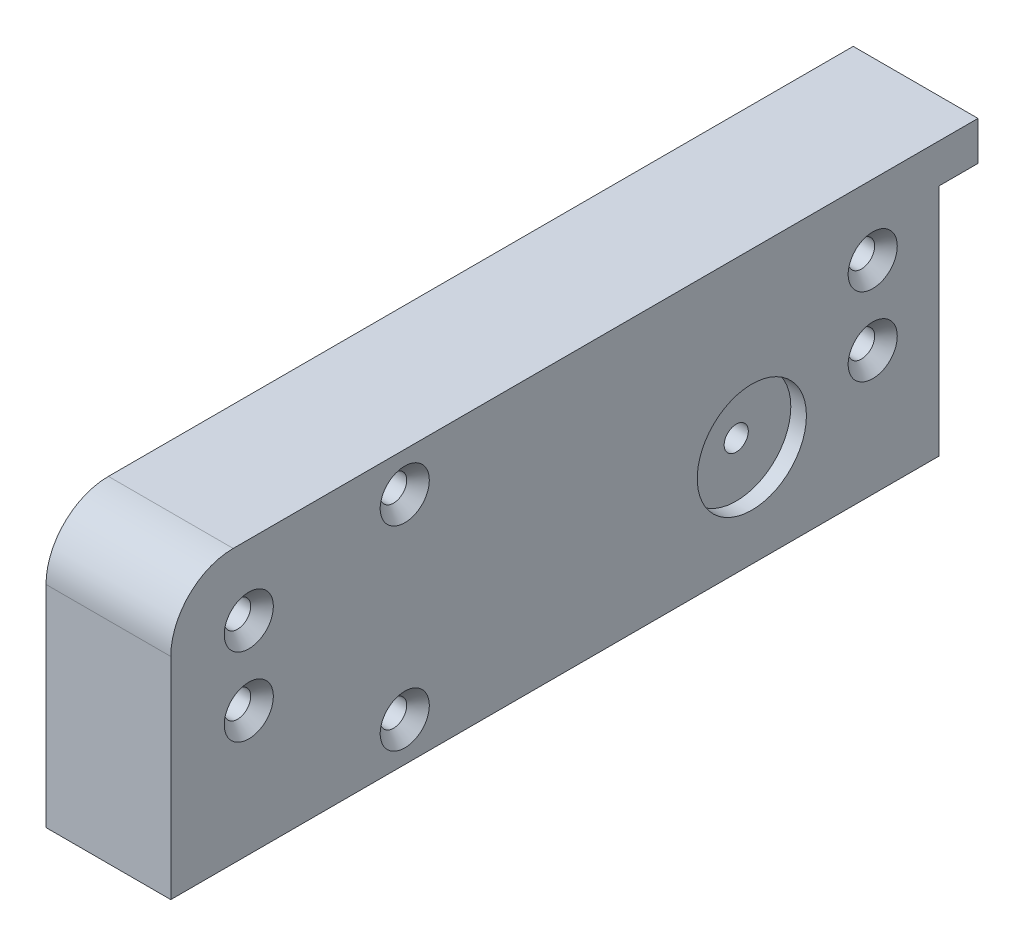
from build123d import *

# Parameters (mm, degrees)
BOSS_EXTRUDE1_DEPTH                                 = 16
CSK_FOR_M3_COUNTERSUNK_FLAT_HEAD_SCREW1_D           = 3.4
CSK_FOR_M3_COUNTERSUNK_FLAT_HEAD_SCREW1_CSINK_D     = 6.3
CSK_FOR_M3_COUNTERSUNK_FLAT_HEAD_SCREW1_CSINK_ANGLE = 90
CUT_EXTRUDE1_DEPTH                                  = 9
SKETCH5_R                                           = 4.1
CUT_EXTRUDE2_DEPTH                                  = 6
SKETCH6_R                                           = 1.55
CUT_EXTRUDE3_DEPTH                                  = 106.750886521
SKETCH7_R                                           = 7
CUT_EXTRUDE4_DEPTH                                  = 2
FILLET1_R                                           = 8


with BuildPart() as part:
    # Sketch1 → Boss-Extrude1 (new body)
    with BuildSketch(Plane(origin=(0, 0, 0), x_dir=(0, 0, -1), z_dir=(1, 0, 0))):
        Polygon((0, 0), (-98.5, 0), (-98.5, 35), (5, 35), (5, 30), (0, 30), align=None)
    extrude(amount=BOSS_EXTRUDE1_DEPTH)

    # CSK for M3 Countersunk Flat Head Screw1 (through all)
    with Locations(Plane(origin=(16, 26, 88.5), x_dir=(0, 0, 1), z_dir=(1, 0, 0))):
        with Locations((0, 0), (0, 10), (-20, -4), (-20, 21), (-80, 0), (-80, 10)):
            CounterSinkHole(CSK_FOR_M3_COUNTERSUNK_FLAT_HEAD_SCREW1_D / 2, CSK_FOR_M3_COUNTERSUNK_FLAT_HEAD_SCREW1_CSINK_D / 2, counter_sink_angle=CSK_FOR_M3_COUNTERSUNK_FLAT_HEAD_SCREW1_CSINK_ANGLE)

    # Sketch4 → Cut-Extrude1 (cut)
    with BuildSketch(Plane.ZY):
        Polygon((10.0875, 28.749630657), (6.9125, 28.749630657), (5.325, 26), (6.9125, 23.250369343), (10.0875, 23.250369343), (11.675, 26), align=None)
        Polygon((86.9125, 28.749630657), (85.325, 26), (86.9125, 23.250369343), (90.0875, 23.250369343), (91.675, 26), (90.0875, 28.749630657), align=None)
    extrude(amount=-CUT_EXTRUDE1_DEPTH, mode=Mode.SUBTRACT)

    # Sketch5 → Cut-Extrude2 (cut)
    with BuildSketch(Plane.ZY):
        with Locations((8.5, 26)):
            Circle(SKETCH5_R)
        with Locations((88.5, 26)):
            Circle(SKETCH5_R)
    extrude(amount=-CUT_EXTRUDE2_DEPTH, mode=Mode.SUBTRACT)

    # Sketch6 → Cut-Extrude3 (cut, through all)
    with BuildSketch(Plane(origin=(16, 0, 0), x_dir=(0, 0, -1), z_dir=(1, 0, 0))):
        with Locations((-24, 13)):
            Circle(SKETCH6_R)
    extrude(amount=-CUT_EXTRUDE3_DEPTH, mode=Mode.SUBTRACT)

    # Sketch7 → Cut-Extrude4 (cut)
    with BuildSketch(Plane(origin=(16, 0, 0), x_dir=(0, 0, -1), z_dir=(1, 0, 0))):
        with Locations((-24, 13)):
            Circle(SKETCH7_R)
    extrude(amount=-CUT_EXTRUDE4_DEPTH, mode=Mode.SUBTRACT)

    # Fillet1
    fillet1_edges = [part.edges().sort_by_distance(p)[0] for p in [
        (8, 35, 98.5),
    ]]
    fillet(fillet1_edges, radius=FILLET1_R)


solid = part.part
